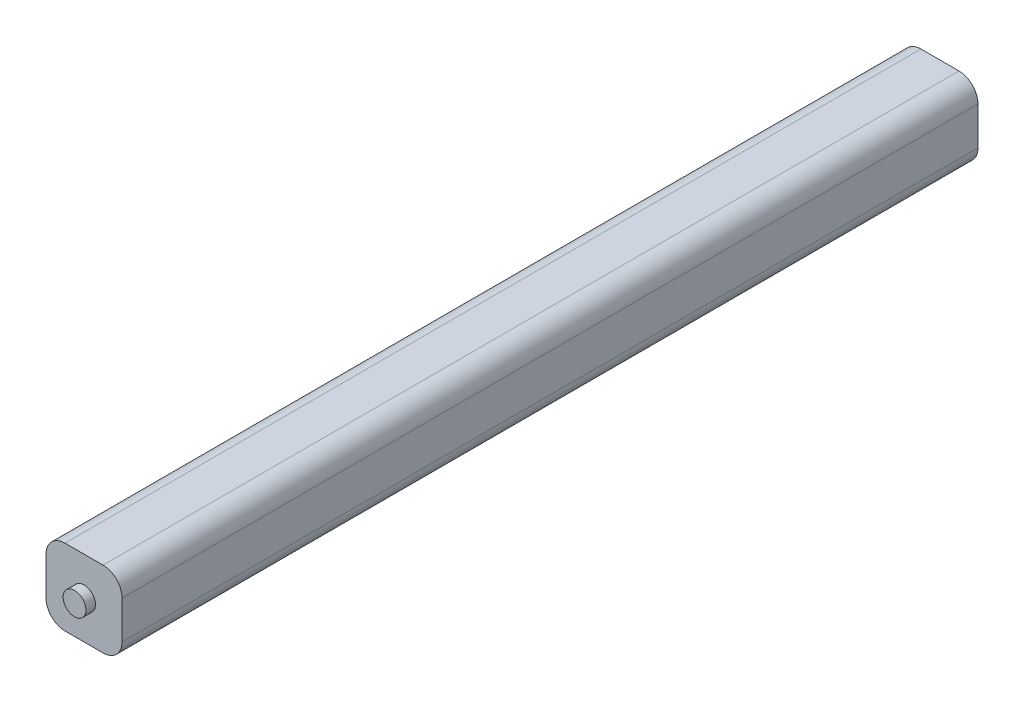
from build123d import *

# Parameters (mm, degrees)
SKETCH_1_R      = 6
EXTRUDE_1_DEPTH = 230
SKETCH_2_W      = 40
SKETCH_2_H      = 40
EXTRUDE_2_DEPTH = 225
FILLET_1_R      = 10


with BuildPart() as part:
    # 草图1 → 凸台-拉伸1 (new, symmetric)
    with BuildSketch(Plane.XY):
        Circle(SKETCH_1_R)
    extrude(amount=EXTRUDE_1_DEPTH, both=True)

    # 草图2 → 凸台-拉伸2 (add, symmetric)
    with BuildSketch(Plane.XY):
        Rectangle(SKETCH_2_W, SKETCH_2_H)
    extrude(amount=EXTRUDE_2_DEPTH, both=True)

    # 圆角1
    fillet_1_edges = [part.edges().sort_by_distance(p)[0] for p in [
        (20, -20, 0),
        (20, 20, 0),
        (-20, 20, 0),
        (-20, -20, 0),
    ]]
    fillet(fillet_1_edges, radius=FILLET_1_R)


solid = part.part
